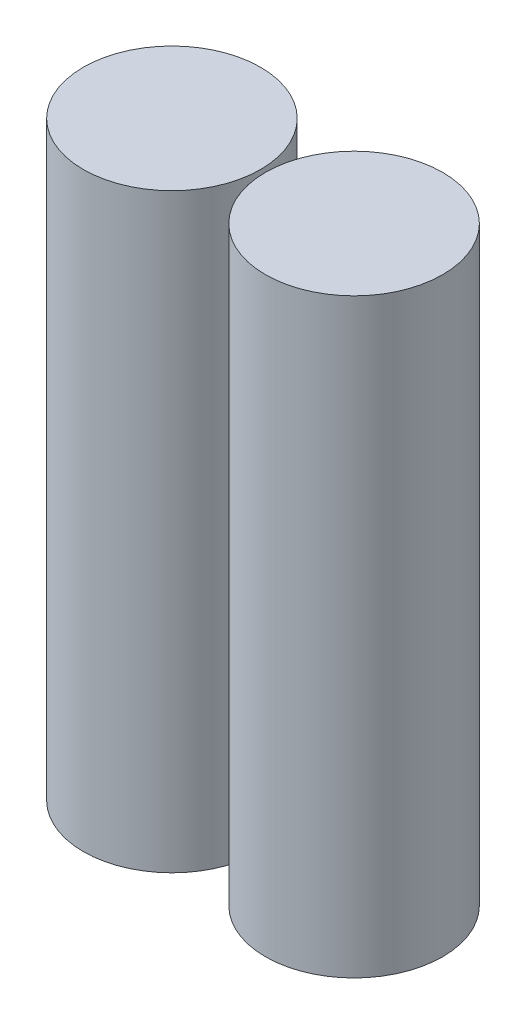
from build123d import *

# Parameters (mm, degrees)
SKETCH_1_R        = 9
EXTRUDE_1_DEPTH   = 60
EXTRUDE_1_2_DEPTH = 60


with BuildPart() as part:
    # 草图1 → 凸台-拉伸1 (new body)
    with BuildSketch(Plane(origin=(0, 0, 0), x_dir=(1, 0, 0), z_dir=(0, 1, 0))):
        with Locations(Location((0, 0, 0), (0, 0, 270))):
            Circle(SKETCH_1_R)
    extrude(amount=EXTRUDE_1_DEPTH)


with BuildPart() as body_2:
    # 草图1 → Extrude 1 2 (new body)
    with BuildSketch(Plane(origin=(0, 0, 0), x_dir=(1, 0, 0), z_dir=(0, 1, 0))):
        with Locations(Location((18.5, 0, 0), (0, 0, 270))):
            Circle(SKETCH_1_R)
    extrude(amount=EXTRUDE_1_2_DEPTH)


solid = Compound([part.part, body_2.part])
